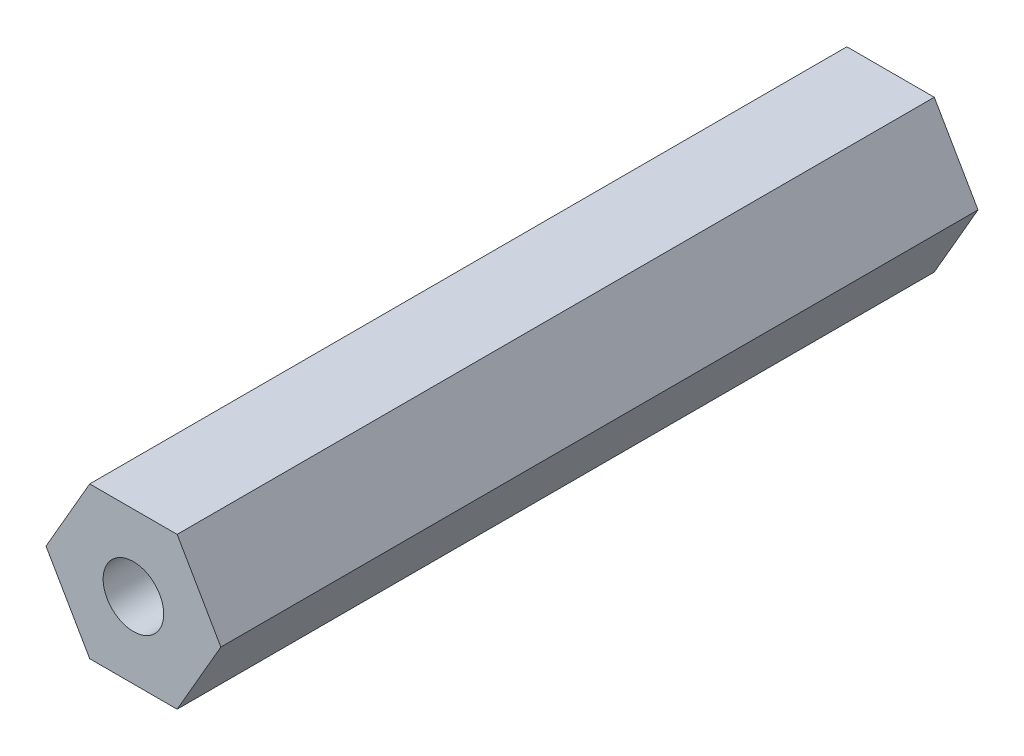
from build123d import *

# Parameters (mm, degrees)
BOSS_EXTRUDE1_DEPTH = 25
SKETCH2_R           = 1
CUT_EXTRUDE1_DEPTH  = 26.289984842


with BuildPart() as part:
    # Sketch1 → Boss-Extrude1 (new body)
    with BuildSketch(Plane.XY):
        Polygon((2.886751346, 0), (1.443375673, 2.5), (-1.443375673, 2.5), (-2.886751346, 0), (-1.443375673, -2.5), (1.443375673, -2.5), align=None)
    extrude(amount=BOSS_EXTRUDE1_DEPTH)

    # Sketch2 → Cut-Extrude1 (cut, through all)
    with BuildSketch(Plane.XY.offset(25)):
        Circle(SKETCH2_R)
    extrude(amount=-CUT_EXTRUDE1_DEPTH, mode=Mode.SUBTRACT)


solid = part.part
